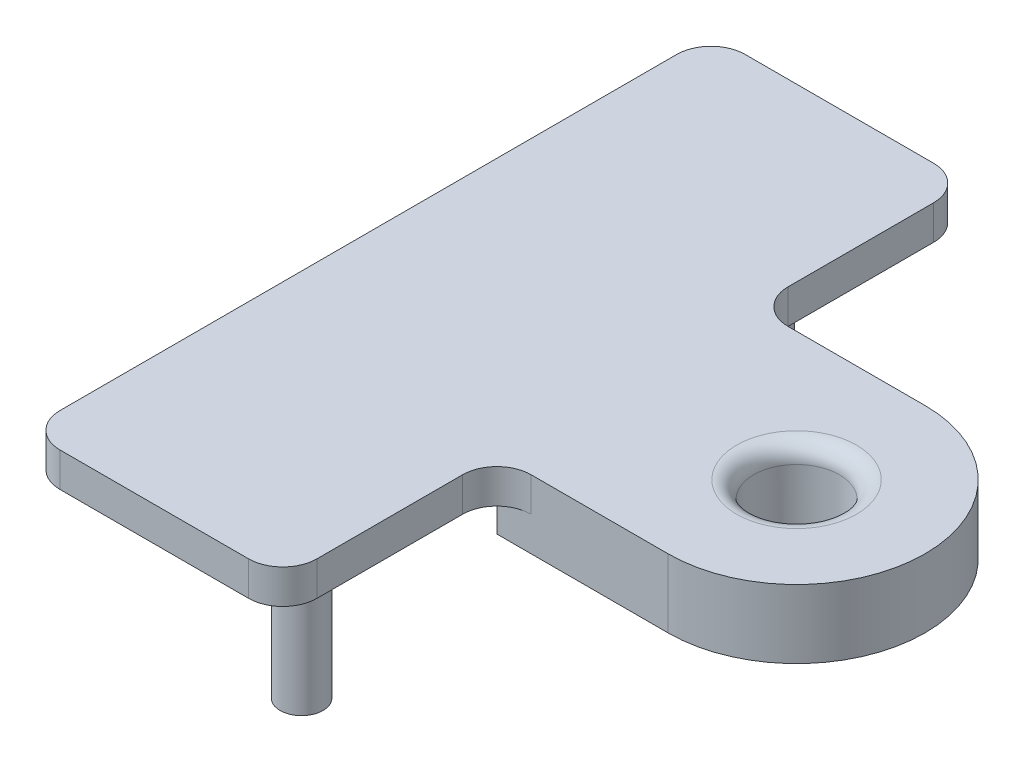
from build123d import *

# Parameters (mm, degrees)
SKETCH_1_W          = 15
SKETCH_1_H          = 40
EXTRUDE_1_DEPTH     = 2
EXTRUDE_2_DEPTH     = 4
SKETCH_3_R          = 1.25
EXTRUDE_3_DEPTH     = 10
CUT_EXTRUDE_1_REACH = 36.191
SKETCH_4_R          = 2.5
FILLET_2_R          = 1
FILLET_3_R          = 2


with BuildPart() as part:
    # 草图1 → 凸台-拉伸1 (new body)
    with BuildSketch(Plane(origin=(0, 0, 0), x_dir=(1, 0, 0), z_dir=(0, 1, 0))):
        Rectangle(SKETCH_1_W, SKETCH_1_H)
    extrude(amount=EXTRUDE_1_DEPTH)

    # 草图2 → 凸台-拉伸2 (add)
    with BuildSketch(Plane(origin=(0, 2, 0), x_dir=(1, 0, 0), z_dir=(0, 1, 0))):
        with BuildLine():
            Line((7.5, -7.5), (17.5, -7.5))
            ThreePointArc((17.5, -7.5), (25, 0), (17.5, 7.5))
            Line((17.5, 7.5), (7.5, 7.5))
            Line((7.5, 7.5), (7.5, -7.5))
        make_face()
    extrude(amount=-EXTRUDE_2_DEPTH)

    # 草图3 → 凸台-拉伸3 (add)
    with BuildSketch(Plane.XZ):
        with Locations(Location((2.1, 13.5, 0), (0, 0, 270))):
            Circle(SKETCH_3_R)
        with Locations(Location((2.1, -13.5, 0), (0, 0, 90))):
            Circle(SKETCH_3_R)
    extrude(amount=EXTRUDE_3_DEPTH)

    # 草图4 → 切除-拉伸1 (cut, up to next)
    with BuildSketch(Plane(origin=(0, 2, 0), x_dir=(1, 0, 0), z_dir=(0, 1, 0)), mode=Mode.PRIVATE) as cut_extrude_1_sk1:
        with Locations(Location((17.5, 0, 0), (0, 0, 270))):
            Circle(SKETCH_4_R)
    cut_extrude_1_tool1 = extrude(cut_extrude_1_sk1.sketch, amount=-CUT_EXTRUDE_1_REACH, mode=Mode.PRIVATE) & part.part
    add(cut_extrude_1_tool1.solids().sort_by_distance((17.5, 2, 0))[0], mode=Mode.SUBTRACT)

    # 圆角2
    fillet_2_edges = [part.edges().sort_by_distance(p)[0] for p in [
        (17.5, 2, -2.5),
    ]]
    fillet(fillet_2_edges, radius=FILLET_2_R)

    # 圆角3
    fillet_3_edges = [part.edges().sort_by_distance(p)[0] for p in [
        (7.5, 1, 7.5),
        (7.5, 1, -7.5),
        (7.5, 1, 20),
        (-7.5, 1, 20),
        (-7.5, 1, -20),
        (7.5, 1, -20),
    ]]
    fillet(fillet_3_edges, radius=FILLET_3_R)


solid = part.part
